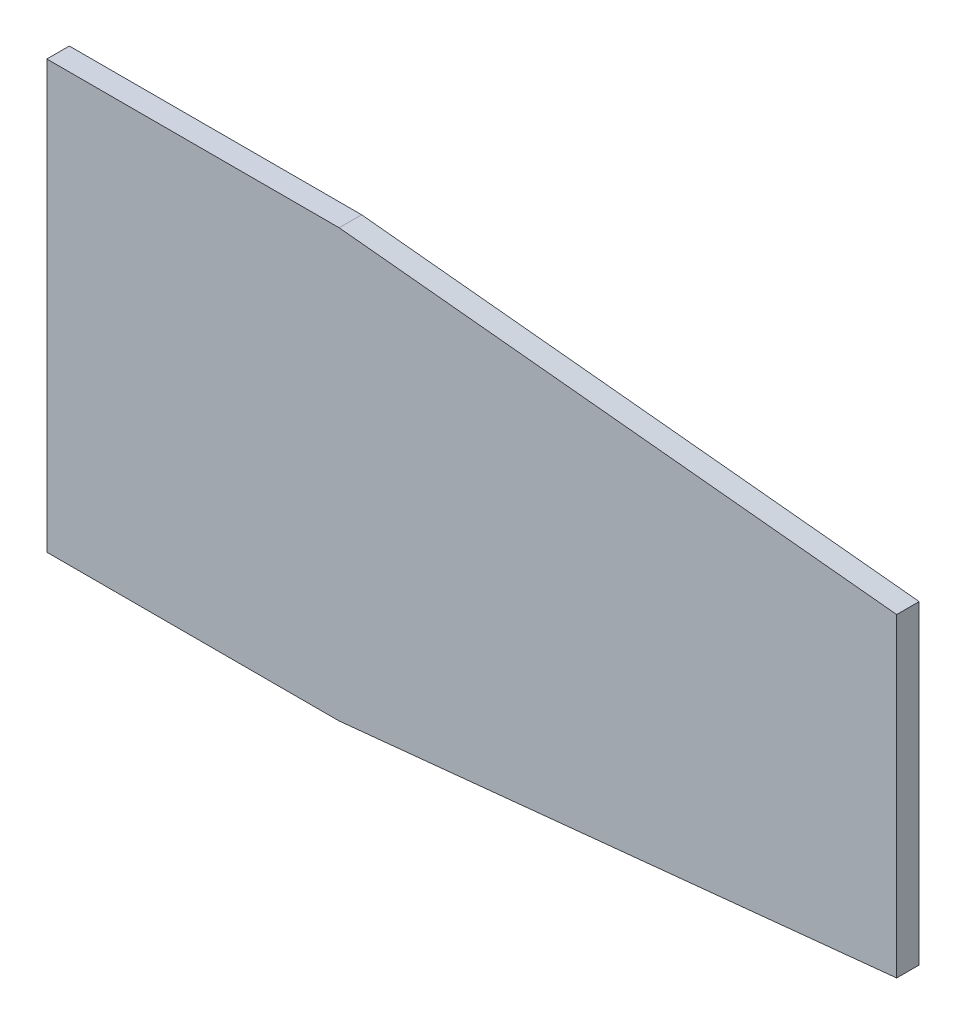
from build123d import *

# Parameters (mm, degrees)
AUFSATZ_LINEAR_AUSTRAGEN1_DEPTH = 5


with BuildPart() as part:
    # Skizze1 → Aufsatz-Linear austragen1 (new body)
    with BuildSketch(Plane.XY):
        Polygon((0, -47.5), (0, 47.5), (65, 47.5), (189, 35), (189, -35), (65, -47.5), align=None)
    extrude(amount=AUFSATZ_LINEAR_AUSTRAGEN1_DEPTH)


solid = part.part
